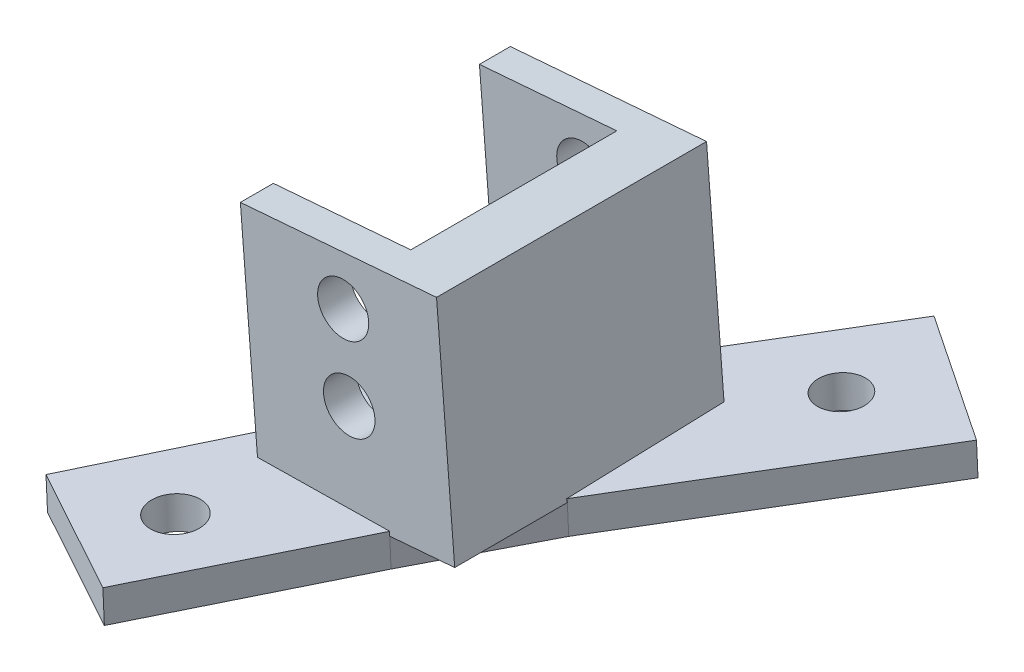
from build123d import *

# Parameters (mm, degrees)
BOSS_EXTRUDE1_DEPTH = 29.21
SKETCH2_R           = 3.175
SKETCH2_R_2         = 3.150896054
BOSS_EXTRUDE2_DEPTH = 4.064
BOSS_EXTRUDE3_START = -3.81
SKETCH3_R           = 3.150896054
SKETCH3_R_2         = 3.175
BOSS_EXTRUDE3_DEPTH = 3.81
SKETCH4_R           = 2.912114347
SKETCH4_R_2         = 3.035248441
BOSS_EXTRUDE4_DEPTH = 4.064


with BuildPart() as part:
    # Sketch1 → Boss-Extrude1 (new body)
    with BuildSketch(Plane.XY):
        with BuildLine():
            Line((-184.947787902, 216.023814704), (-197.134551999, 215.040325013))
            Line((-197.134551999, 215.040325013), (-196.807644057, 210.989494579))
            Line((-196.807644057, 210.989494579), (-172.630398999, 212.940633626))
            Line((-172.630398999, 212.940633626), (-174.867675228, 240.663504402))
            Line((-174.867675228, 240.663504402), (-182.112910704, 240.0788033))
            ThreePointArc((-182.112910704, 240.0788033), (-179.090453568, 236.146361834), (-179.097761142, 231.186594741))
            ThreePointArc((-179.097761142, 231.186594741), (-179.357825473, 229.166849047), (-178.803768808, 227.207250277))
            ThreePointArc((-178.803768808, 227.207250277), (-178.89422454, 219.977509591), (-184.947787902, 216.023814704))
        make_face()
    extrude(amount=-BOSS_EXTRUDE1_DEPTH)

    # Sketch2 → Boss-Extrude2 (add)
    with BuildSketch(Plane.XY):
        Polygon((-174.867675228, 240.663504402), (-172.630398999, 212.940633626), (-196.807644057, 210.989494579), (-199.044920286, 238.712365356), align=None)
        with Locations((-185.628460018, 223.67720197)):
            Circle(SKETCH2_R, mode=Mode.SUBTRACT)
        with Locations((-186.37244208, 233.67720197)):
            Circle(SKETCH2_R_2, mode=Mode.SUBTRACT)
    extrude(amount=BOSS_EXTRUDE2_DEPTH)

    # Sketch3 → Boss-Extrude3 (add)
    with BuildSketch(Plane(origin=(0, 0, -29.21), x_dir=(-1, 0, 0), z_dir=(0, 0, -1)).offset(BOSS_EXTRUDE3_START)):
        with BuildLine():
            Line((197.134551999, 215.040325013), (199.044920286, 238.712365356))
            Line((199.044920286, 238.712365356), (182.112910704, 240.0788033))
            ThreePointArc((182.112910704, 240.0788033), (179.090453568, 236.146361834), (179.097761142, 231.186594741))
            ThreePointArc((179.097761142, 231.186594741), (179.357825473, 229.166849047), (178.803768808, 227.207250277))
            ThreePointArc((178.803768808, 227.207250277), (178.89422454, 219.977509591), (184.947787902, 216.023814704))
            Line((184.947787902, 216.023814704), (197.134551999, 215.040325013))
        make_face()
        with Locations(Location((186.37244208, 233.67720197, 0), (0, 0, 180))):
            Circle(SKETCH3_R, mode=Mode.SUBTRACT)
        with Locations(Location((185.628460018, 223.67720197, 0), (0, 0, 180))):
            Circle(SKETCH3_R_2, mode=Mode.SUBTRACT)
    extrude(amount=BOSS_EXTRUDE3_DEPTH)

    # Sketch4 → Boss-Extrude4 (add)
    with BuildSketch(Plane(origin=(-3.401075391, 215.535251129, 6.555182159), x_dir=(0.9998756392437431, 0.015763128213975516, 0.0004794119583323757), z_dir=(-0.01577041682759283, 0.9994135267149824, 0.030395666997208134))):
        Polygon((-178.918526698, 35.997686208), (-164.828562801, 57.087586654), (-149.044849512, 46.542636431), (-169.257027987, 16.288986745), (-177.265593638, 2.391514831), (-189.802185869, -20.421476842), (-205.369032328, -11.866912445), (-194.539107817, 8.279817663), align=None)
        with Locations(Location((-162.788777802, 43.630522083, 0), (0, 0, 270))):
            Circle(SKETCH4_R, mode=Mode.SUBTRACT)
        with Locations(Location((-192.870314924, -8.404113006, 0), (0, 0, 270))):
            Circle(SKETCH4_R_2, mode=Mode.SUBTRACT)
    extrude(amount=-BOSS_EXTRUDE4_DEPTH)


solid = part.part
